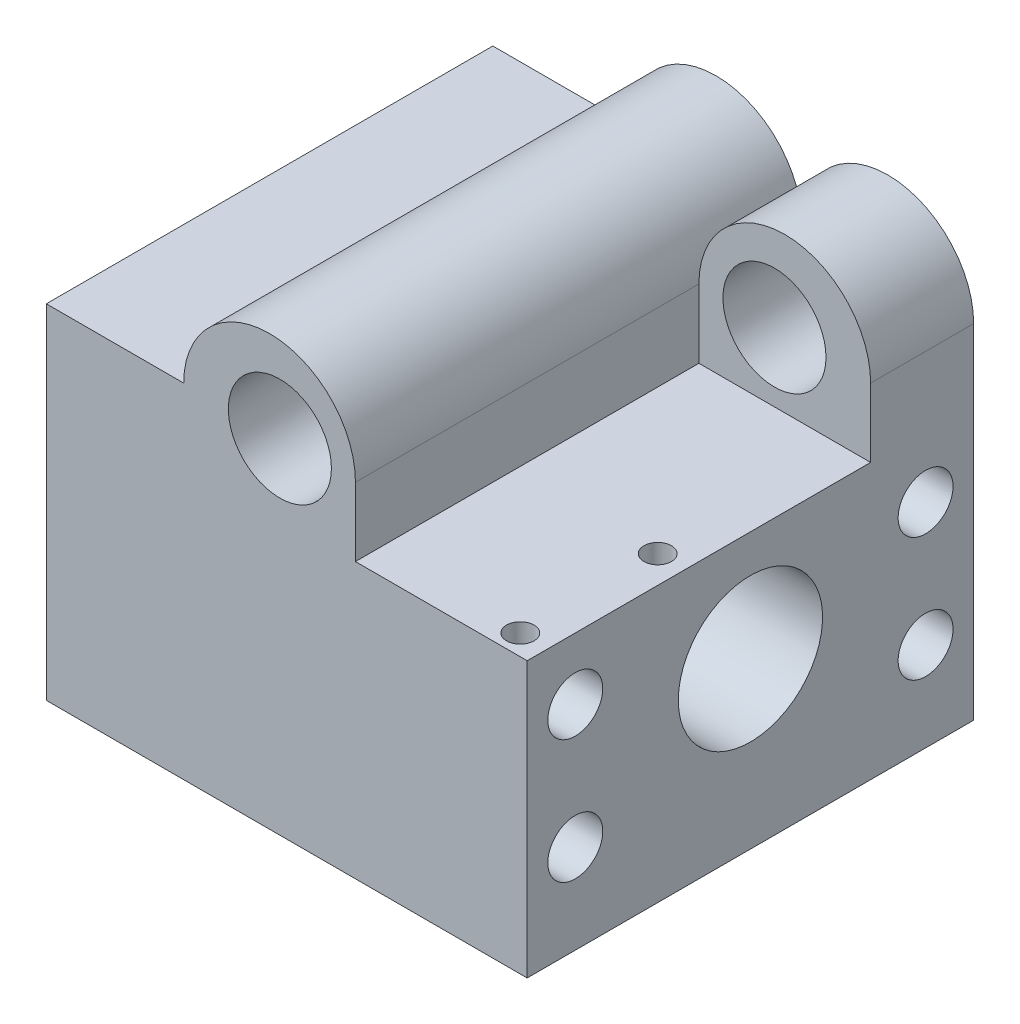
from build123d import *
from build123d.topology import SkipClean

# Parameters (mm, degrees)
SKETCH1_R               = 7.5
BOSS_EXTRUDE1_DEPTH     = 15
SKETCH2_R               = 7.5
BOSS_EXTRUDE2_DEPTH     = 50
SKETCH3_W               = 50
SKETCH3_H               = 40
BOSS_EXTRUDE3_DEPTH     = 65
CUT_EXTRUDE2_DEPTH      = 96.372952141
SKETCH9_R               = 4
SKETCH9_R_2             = 10.5
CUT_EXTRUDE3_DEPTH      = 104.107953137
ESQUISSE1_R             = 2
ENL_V_MAT_EXTRU_1_DEPTH = 10
ESQUISSE3_W             = 65
ESQUISSE3_H             = 50
ESQUISSE3_R             = 1.5
ESQUISSE3_R_2           = 11
BOSS_EXTRU_1_DEPTH      = 5
ESQUISSE3_4_W           = 65
ESQUISSE3_4_H           = 50
ESQUISSE3_4_W_2         = 42
ESQUISSE3_4_H_2         = 42
BOSS_EXTRU_2_DEPTH      = 20
ENL_V_START             = -20
ESQUISSE3_5_R           = 1.5
ENL_V_MAT_EXTRU_4_DEPTH = 20


with BuildPart() as part:
    # Sketch1 → Boss-Extrude1 (new body)
    with BuildSketch(Plane.XY):
        with BuildLine():
            Line((0, 0), (50, 0))
            Line((50, 0), (50, 50))
            ThreePointArc((50, 50), (40.582575695, 63.228756555), (25, 58.660254038))
            ThreePointArc((25, 58.660254038), (9.417424305, 63.228756555), (0, 50))
            Line((0, 50), (0, 0))
        make_face()
        with Locations((36, 50)):
            Circle(SKETCH1_R, mode=Mode.SUBTRACT)
        with Locations((14, 50)):
            Circle(SKETCH1_R, mode=Mode.SUBTRACT)
    extrude(amount=BOSS_EXTRUDE1_DEPTH)

    # Sketch2 → Boss-Extrude2 (add)
    with BuildSketch(Plane.XY.offset(15)):
        with BuildLine():
            Line((0, 50), (0, 0))
            Line((0, 0), (25, 0))
            Line((25, 0), (25, 50))
            ThreePointArc((25, 50), (12.5, 62.5), (0, 50))
        make_face()
        with Locations((14, 50)):
            Circle(SKETCH2_R, mode=Mode.SUBTRACT)
    extrude(amount=BOSS_EXTRUDE2_DEPTH)

    # Sketch3 → Boss-Extrude3 (add)
    with BuildSketch(Plane(origin=(0, 0, 0), x_dir=(-1, 0, 0), z_dir=(0, 0, -1))):
        with Locations((-25, 20)):
            Rectangle(SKETCH3_W, SKETCH3_H)
    extrude(amount=-BOSS_EXTRUDE3_DEPTH)

    # Sketch2<3> → Cut-Extrude2 (cut, through all)
    with BuildSketch(Plane.XY.offset(15)):
        with BuildLine():
            ThreePointArc((25, 58.660254038), (9.417424305, 63.228756555), (0, 50))
            ThreePointArc((0, 50), (12.5, 62.5), (25, 50))
            ThreePointArc((25, 50), (37.5, 62.5), (50, 50))
            ThreePointArc((50, 50), (40.582575695, 63.228756555), (25, 58.660254038))
        make_face()
    extrude(amount=-CUT_EXTRUDE2_DEPTH, mode=Mode.SUBTRACT)

    # Sketch9 → Cut-Extrude3 (cut, through all)
    with BuildSketch(Plane.ZY):
        with Locations((58, 13)):
            Circle(SKETCH9_R)
        with Locations((7, 13)):
            Circle(SKETCH9_R)
        with Locations((7, 31)):
            Circle(SKETCH9_R)
        with Locations((58, 31)):
            Circle(SKETCH9_R)
        with Locations((32.5, 24)):
            Circle(SKETCH9_R_2)
    extrude(amount=-CUT_EXTRUDE3_DEPTH, mode=Mode.SUBTRACT)

    # Esquisse1 → Enlèv. mat.-Extru.1 (cut)
    with SkipClean():  # the faces are left unmerged after this step: merging them gives an invalid solid
        with BuildSketch(Plane(origin=(0, 40, 0), x_dir=(1, 0, 0), z_dir=(0, 1, 0))):
            with Locations((46, -42)):
                Circle(ESQUISSE1_R)
            with Locations((46, -62)):
                Circle(ESQUISSE1_R)
        extrude(amount=-ENL_V_MAT_EXTRU_1_DEPTH, mode=Mode.SUBTRACT)

    # Esquisse3 → Boss.-Extru.1 (add)
    with SkipClean():  # the faces are left unmerged after this step: merging them gives an invalid solid
        with BuildSketch(Plane.ZY):
            with Locations((32.5, 25)):
                Rectangle(ESQUISSE3_W, ESQUISSE3_H)
            with Locations((17, 7.5)):
                Circle(ESQUISSE3_R, mode=Mode.SUBTRACT)
            with Locations((48, 7.5)):
                Circle(ESQUISSE3_R, mode=Mode.SUBTRACT)
            with Locations((32.5, 24)):
                Circle(ESQUISSE3_R_2, mode=Mode.SUBTRACT)
            with Locations((17, 38.5)):
                Circle(ESQUISSE3_R, mode=Mode.SUBTRACT)
            with Locations((48, 38.5)):
                Circle(ESQUISSE3_R, mode=Mode.SUBTRACT)
        extrude(amount=BOSS_EXTRU_1_DEPTH)

    # Esquisse3<4> → Boss.-Extru.2 (add)
    with SkipClean():  # the faces are left unmerged after this step: merging them gives an invalid solid
        with BuildSketch(Plane.ZY):
            with Locations((32.5, 25)):
                Rectangle(ESQUISSE3_4_W, ESQUISSE3_4_H)
            with Locations((32.5, 23)):
                Rectangle(ESQUISSE3_4_W_2, ESQUISSE3_4_H_2, mode=Mode.SUBTRACT)
        extrude(amount=BOSS_EXTRU_2_DEPTH)

    # Esquisse3<5> → Enlèv. mat.-Extru.4 (cut)
    with SkipClean():  # the faces are left unmerged after this step: merging them gives an invalid solid
        with BuildSketch(Plane.ZY.offset(ENL_V_START)):
            with Locations((17, 38.5)):
                Circle(ESQUISSE3_5_R)
            with Locations((48, 38.5)):
                Circle(ESQUISSE3_5_R)
            with Locations((48, 7.5)):
                Circle(ESQUISSE3_5_R)
            with Locations((17, 7.5)):
                Circle(ESQUISSE3_5_R)
        extrude(amount=ENL_V_MAT_EXTRU_4_DEPTH, mode=Mode.SUBTRACT)


solid = part.part
